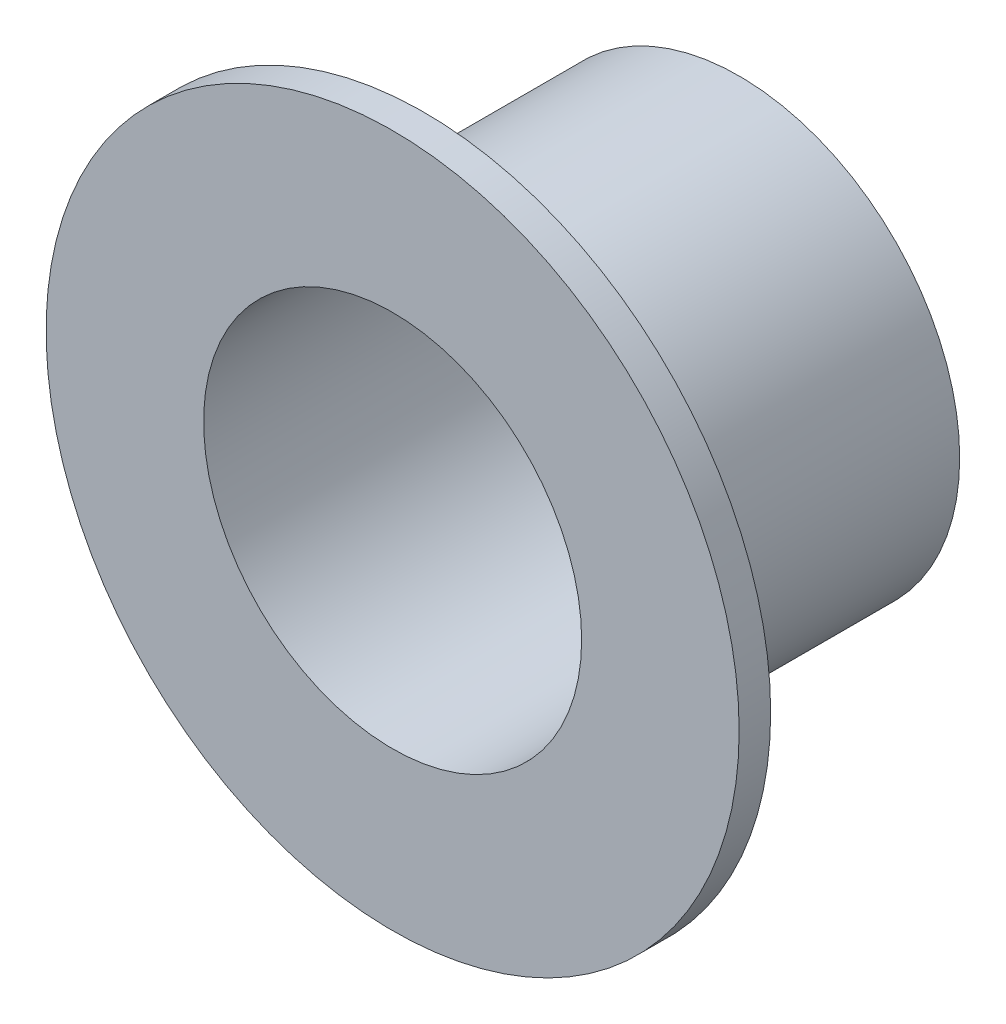
from build123d import *

# Parameters (mm, degrees)
SZKIC1_R                    = 3.5
SZKIC1_R_2                  = 3
DODANIE_WYCI_GNI_CIE1_DEPTH = 5.5
DODANIE_WYCI_GNI_CIE2_START = -0.5
SZKIC2_R                    = 5.5
SZKIC2_R_2                  = 3
DODANIE_WYCI_GNI_CIE2_DEPTH = 0.5


with BuildPart() as part:
    # Szkic1 → Dodanie-wyciągnięcie1 (new body)
    with BuildSketch(Plane.XY):
        Circle(SZKIC1_R)
        Circle(SZKIC1_R_2, mode=Mode.SUBTRACT)
    extrude(amount=DODANIE_WYCI_GNI_CIE1_DEPTH)

    # Szkic2 → Dodanie-wyciągnięcie2 (add)
    with BuildSketch(Plane.XY.offset(5.5).offset(DODANIE_WYCI_GNI_CIE2_START)):
        Circle(SZKIC2_R)
        Circle(SZKIC2_R_2, mode=Mode.SUBTRACT)
    extrude(amount=DODANIE_WYCI_GNI_CIE2_DEPTH)


solid = part.part
